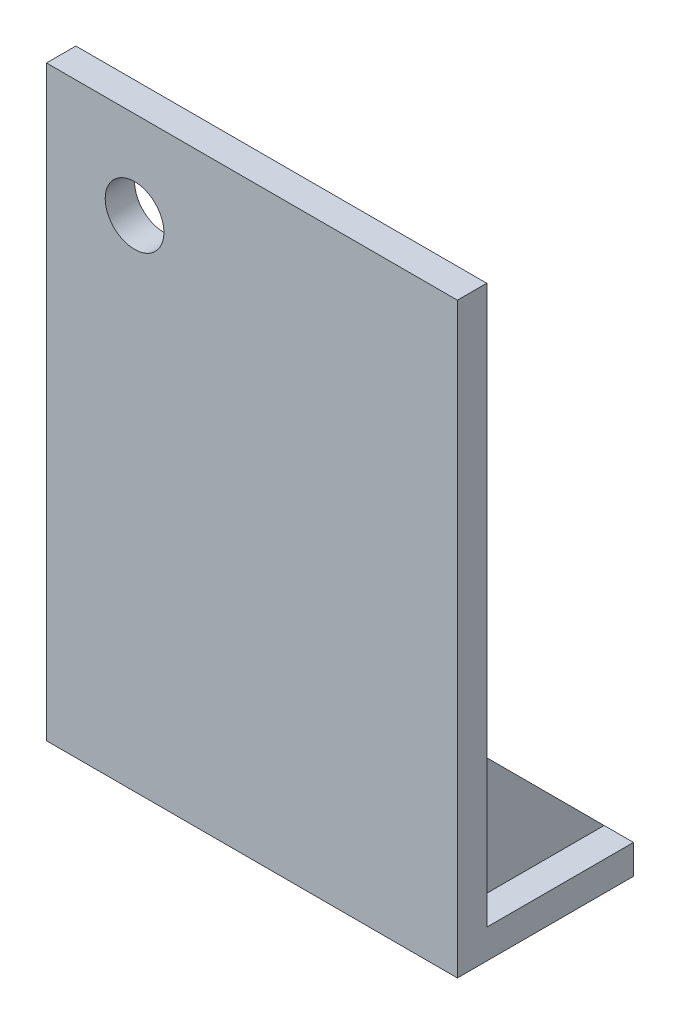
from build123d import *

# Parameters (mm, degrees)
BOSS_EXTRUDE1_DEPTH = 5
SKETCH9_R           = 5
CUT_EXTRUDE4_DEPTH  = 10
SKETCH10_W          = 45.027348062
SKETCH10_H          = 31.505755331
CUT_EXTRUDE5_DEPTH  = 10
SKETCH11_W          = 70
SKETCH11_H          = 95
BOSS_EXTRUDE2_DEPTH = 5
SKETCH12_R          = 5
CUT_EXTRUDE6_DEPTH  = 5
SKETCH13_W          = 70
SKETCH13_H          = 30
BOSS_EXTRUDE3_DEPTH = 5
BOSS_EXTRUDE4_DEPTH = 5


with BuildPart() as part:
    # Sketch1 → Boss-Extrude1 (new body)
    with BuildSketch(Plane.XY):
        with BuildLine():
            Line((5, 0), (70, 0))
            Line((70, 0), (70, -30))
            Line((70, -30), (70, -95))
            Line((70, -95), (40, -95))
            Line((40, -95), (40, -30))
            Line((40, -30), (5, -30))
            ThreePointArc((5, -30), (1.464466094, -28.535533906), (0, -25))
            Line((0, -25), (0, -5))
            ThreePointArc((0, -5), (1.464466094, -1.464466094), (5, 0))
        make_face()
    boss_extrude1 = extrude(amount=BOSS_EXTRUDE1_DEPTH)

    # Mirror4: Boss-Extrude1 across plane
    add(boss_extrude1.mirror(Plane.ZY.offset(-55)))

    # Sketch9 → Cut-Extrude4 (cut)
    with BuildSketch(Plane(origin=(0, 0, 0), x_dir=(-1, 0, 0), z_dir=(0, 0, -1))):
        with Locations((-95, -15)):
            Circle(SKETCH9_R)
    extrude(amount=-CUT_EXTRUDE4_DEPTH, mode=Mode.SUBTRACT)

    # Sketch10 → Cut-Extrude5 (cut)
    with BuildSketch(Plane(origin=(0, 0, 0), x_dir=(-1, 0, 0), z_dir=(0, 0, -1))):
        with Locations((-17.486325969, -14.247122335)):
            Rectangle(SKETCH10_W, SKETCH10_H)
    extrude(amount=-CUT_EXTRUDE5_DEPTH, mode=Mode.SUBTRACT)

    # Sketch11 → Boss-Extrude2 (add)
    with BuildSketch(Plane(origin=(0, 0, 0), x_dir=(-1, 0, 0), z_dir=(0, 0, -1))):
        with Locations((-75, -47.5)):
            Rectangle(SKETCH11_W, SKETCH11_H)
    extrude(amount=-BOSS_EXTRUDE2_DEPTH)

    # Sketch12 → Cut-Extrude6 (cut)
    with BuildSketch(Plane(origin=(0, 0, 0), x_dir=(-1, 0, 0), z_dir=(0, 0, -1))):
        with Locations((-55, -15)):
            Circle(SKETCH12_R)
    extrude(amount=-CUT_EXTRUDE6_DEPTH, mode=Mode.SUBTRACT)

    # Sketch13 → Boss-Extrude3 (add)
    with BuildSketch(Plane.XZ.offset(95)):
        with Locations((75, -10)):
            Rectangle(SKETCH13_W, SKETCH13_H)
    extrude(amount=BOSS_EXTRUDE3_DEPTH)

    # Sketch14 → Boss-Extrude4 (add)
    with BuildSketch(Plane(origin=(100, 0, 0), x_dir=(0, 0, -1), z_dir=(1, 0, 0))):
        Polygon((0, -70), (25, -95), (0, -95), align=None)
    extrude(amount=BOSS_EXTRUDE4_DEPTH)


solid = part.part
